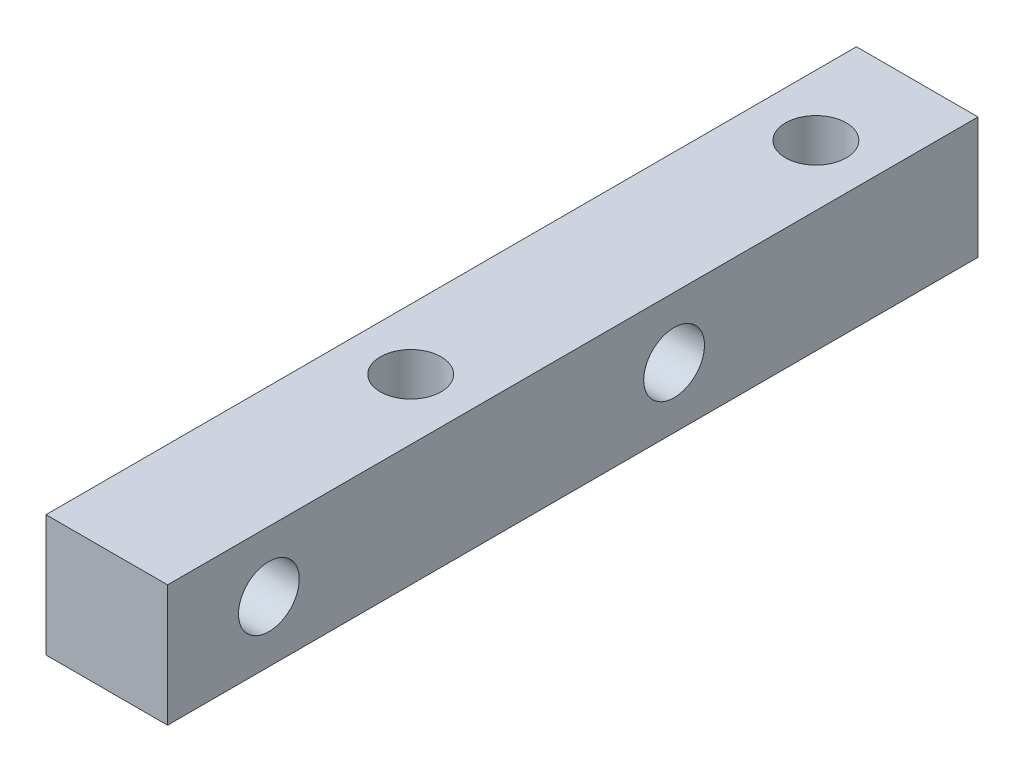
from build123d import *

# Parameters (mm, degrees)
SKETCH_1_W          = 6
SKETCH_1_H          = 6
EXTRUDE_1_DEPTH     = 20
SKETCH_2_R          = 1.5
CUT_EXTRUDE_1_DEPTH = 22.09502311
SKETCH_3_R          = 1.5
CUT_EXTRUDE_2_DEPTH = 22.09502311


with BuildPart() as part:
    # 草图1 → 凸台-拉伸1 (new, symmetric)
    with BuildSketch(Plane.XY):
        Rectangle(SKETCH_1_W, SKETCH_1_H)
    extrude(amount=EXTRUDE_1_DEPTH, both=True)

    # 草图2 → 切除-拉伸1 (cut, through all)
    with BuildSketch(Plane(origin=(3, 0, 0), x_dir=(0, 0, -1), z_dir=(1, 0, 0))):
        with Locations(Location((-15, 0, 0), (0, 0, 90))):
            Circle(SKETCH_2_R)
        with Locations(Location((5, 0, 0), (0, 0, 90))):
            Circle(SKETCH_2_R)
    extrude(amount=-CUT_EXTRUDE_1_DEPTH, mode=Mode.SUBTRACT)

    # 草图3 → 切除-拉伸2 (cut, through all)
    with BuildSketch(Plane(origin=(0, 3, 0), x_dir=(1, 0, 0), z_dir=(0, 1, 0))):
        with Locations(Location((0, 15, 0), (0, 0, 180))):
            Circle(SKETCH_3_R)
        with Locations(Location((0, -5, 0), (0, 0, 180))):
            Circle(SKETCH_3_R)
    extrude(amount=-CUT_EXTRUDE_2_DEPTH, mode=Mode.SUBTRACT)


solid = part.part
